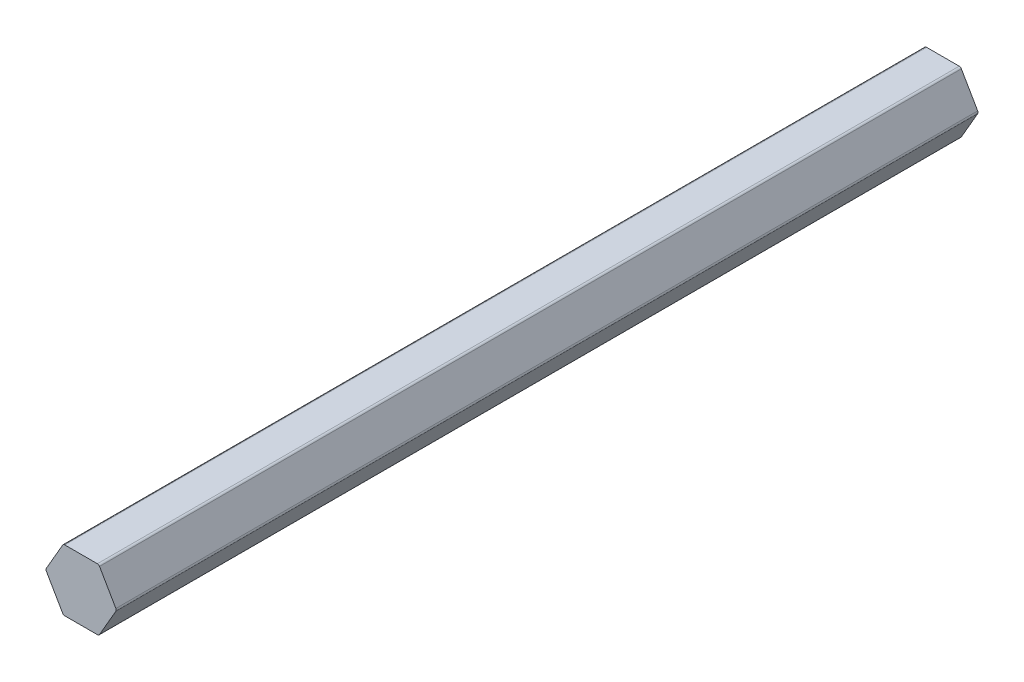
from build123d import *

# Parameters (mm, degrees)
BOSS_EXTRUDE1_DEPTH = 88.9


with BuildPart() as part:
    # Sketch1 → Boss-Extrude1 (new, symmetric)
    with BuildSketch(Plane.XY):
        with BuildLine():
            Line((-7.171036753, -0.254), (-3.805488829, -6.0833))
            ThreePointArc((-3.805488829, -6.0833), (-3.619547924, -6.269240905), (-3.365547924, -6.3373))
            Line((-3.365547924, -6.3373), (3.365547924, -6.3373))
            ThreePointArc((3.365547924, -6.3373), (3.619547924, -6.269240905), (3.805488829, -6.0833))
            Line((3.805488829, -6.0833), (7.171036753, -0.254))
            ThreePointArc((7.171036753, -0.254), (7.239095848, 0), (7.171036753, 0.254))
            Line((7.171036753, 0.254), (3.805488829, 6.0833))
            ThreePointArc((3.805488829, 6.0833), (3.619547924, 6.269240905), (3.365547924, 6.3373))
            Line((3.365547924, 6.3373), (-3.365547924, 6.3373))
            ThreePointArc((-3.365547924, 6.3373), (-3.619547924, 6.269240905), (-3.805488829, 6.0833))
            Line((-3.805488829, 6.0833), (-7.171036753, 0.254))
            ThreePointArc((-7.171036753, 0.254), (-7.239095848, 0), (-7.171036753, -0.254))
        make_face()
    extrude(amount=BOSS_EXTRUDE1_DEPTH, both=True)


solid = part.part
